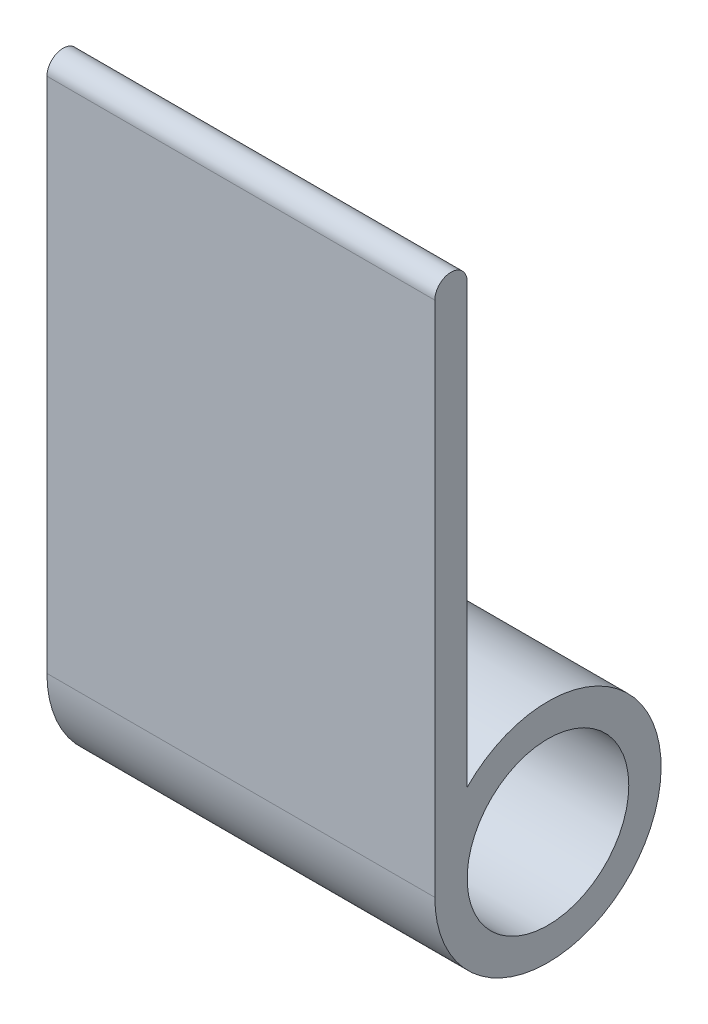
from build123d import *

# Parameters (mm, degrees)
SKETCH1_R           = 12.5
BOSS_EXTRUDE1_DEPTH = 60
SKETCH2_R           = 5.6
BOSS_EXTRUDE2_DEPTH = 5


with BuildPart() as part:
    # Sketch1 → Boss-Extrude1 (new body)
    with BuildSketch(Plane(origin=(0, 0, 0), x_dir=(0, 0, -1), z_dir=(1, 0, 0))):
        with BuildLine():
            Line((-17.5, 0), (-17.5, 80))
            ThreePointArc((-17.5, 80), (-15, 82.5), (-12.5, 80))
            Line((-12.5, 80), (-12.5, 12.247448714))
            ThreePointArc((-12.5, 12.247448714), (16.201851746, -6.614378278), (-17.5, 0))
        make_face()
        Circle(SKETCH1_R, mode=Mode.SUBTRACT)
    extrude(amount=BOSS_EXTRUDE1_DEPTH)

    # Sketch2 → Boss-Extrude2 (add)
    with BuildSketch(Plane(origin=(0, 0, 0), x_dir=(0, 0, -1), z_dir=(1, 0, 0))):
        with BuildLine():
            ThreePointArc((2.5, 24.720508076), (11.1, 33.320508076), (2.5, 41.920508076))
            Line((2.5, 41.920508076), (-12.5, 41.920508076))
            Line((-12.5, 41.920508076), (-12.5, 12.247448714))
            ThreePointArc((-12.5, 12.247448714), (-5.606601718, 16.577575733), (2.5, 17.320508076))
            Line((2.5, 17.320508076), (2.5, 24.720508076))
        make_face()
        with Locations((2.5, 33.320508076)):
            Circle(SKETCH2_R, mode=Mode.SUBTRACT)
    extrude(amount=BOSS_EXTRUDE2_DEPTH)


solid = part.part
